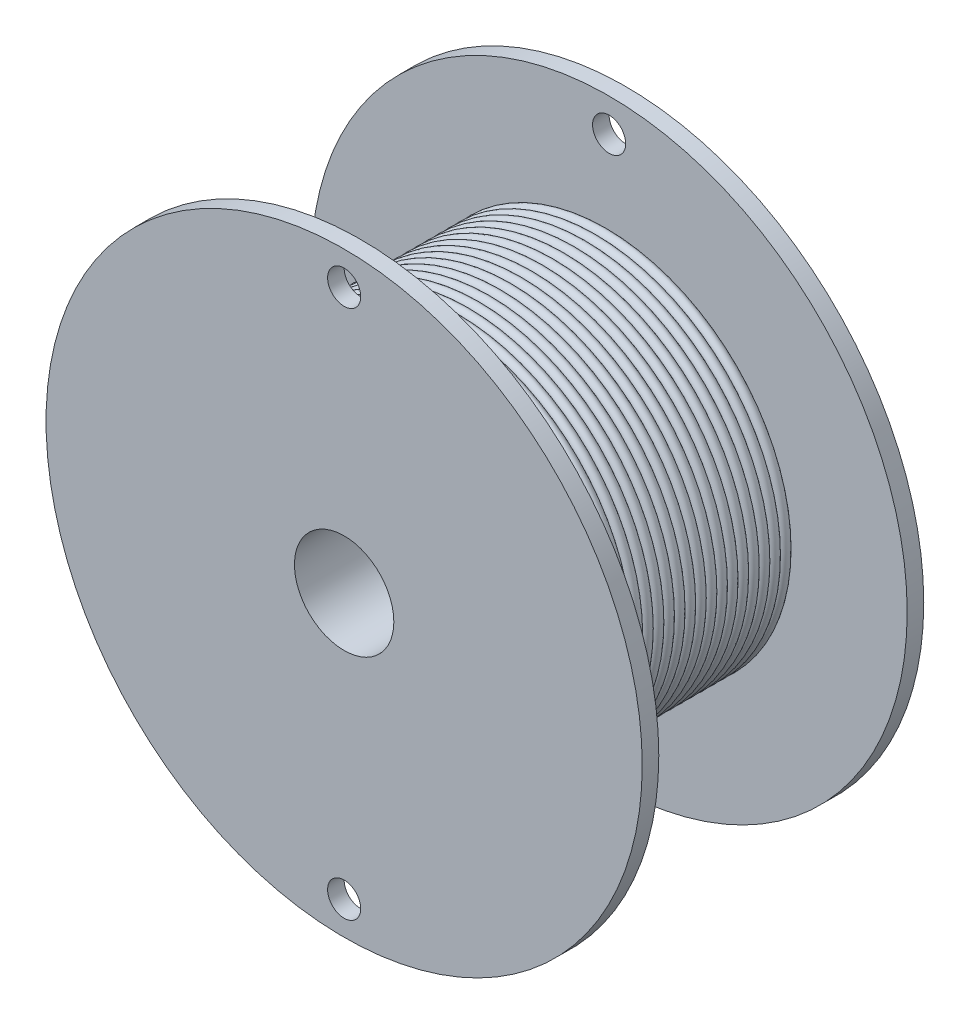
from build123d import *

# Parameters (mm, degrees)
SKETCH_1_R             = 90
EXTRUDE_1_DEPTH        = 5
SKETCH_2_R             = 30
EXTRUDE_2_DEPTH        = 80
PATTERN_LINEAR_1_COUNT = 2
PATTERN_LINEAR_1_PITCH = 80
SKETCH_5_R             = 1.532153127
SKETCH_6_R             = 15
SKETCH_6_R_2           = 5
CUT_EXTRUDE_1_DEPTH    = 154.05227865


with BuildPart() as part:
    # 草圖1 → 填料-伸長1 (new body)
    with BuildSketch(Plane.XY):
        Circle(SKETCH_1_R)
    extrude_1 = extrude(amount=EXTRUDE_1_DEPTH)

    # 草圖2 → 填料-伸長2 (add)
    with BuildSketch(Plane(origin=(0, 0, 0), x_dir=(-1, 0, 0), z_dir=(0, 0, -1))):
        with Locations(Location((0, 0, 0), (0, 0, 180))):
            Circle(SKETCH_2_R)
    extrude(amount=EXTRUDE_2_DEPTH)

    # 直線複製排列1: 填料-伸長1 ×2
    with Locations(*[(0, 0, -i * PATTERN_LINEAR_1_PITCH) for i in range(1, PATTERN_LINEAR_1_COUNT)]):
        add(extrude_1)

    # 草圖6 → 除料-伸長1 (cut, through all)
    with BuildSketch(Plane.XY.offset(5)):
        Circle(SKETCH_6_R)
        with Locations((0, 80)):
            Circle(SKETCH_6_R_2)
        with Locations((0, -80)):
            Circle(SKETCH_6_R_2)
    extrude(amount=-CUT_EXTRUDE_1_DEPTH, mode=Mode.SUBTRACT)


with BuildPart() as body_2:
    # 草圖5 → 旋轉2 (revolve)
    with BuildSketch(Plane(origin=(0, 0, 0), x_dir=(0, 0, -1), z_dir=(1, 0, 0)), mode=Mode.PRIVATE) as revolve_2_sk:
        with Locations((2.530298984, 54.841798539)):
            Circle(SKETCH_5_R)
        with Locations((5.730298984, 54.841798539)):
            Circle(SKETCH_5_R)
        with Locations((8.930298984, 54.841798539)):
            Circle(SKETCH_5_R)
        with Locations((12.130298984, 54.841798539)):
            Circle(SKETCH_5_R)
        with Locations((15.330298984, 54.841798539)):
            Circle(SKETCH_5_R)
        with Locations((18.530298984, 54.841798539)):
            Circle(SKETCH_5_R)
        with Locations((21.730298984, 54.841798539)):
            Circle(SKETCH_5_R)
        with Locations((24.930298984, 54.841798539)):
            Circle(SKETCH_5_R)
        with Locations((28.130298984, 54.841798539)):
            Circle(SKETCH_5_R)
        with Locations((31.330298984, 54.841798539)):
            Circle(SKETCH_5_R)
        with Locations((34.530298984, 54.841798539)):
            Circle(SKETCH_5_R)
        with Locations((37.730298984, 54.841798539)):
            Circle(SKETCH_5_R)
        with Locations((40.930298984, 54.841798539)):
            Circle(SKETCH_5_R)
        with Locations((44.130298984, 54.841798539)):
            Circle(SKETCH_5_R)
        with Locations((47.330298984, 54.841798539)):
            Circle(SKETCH_5_R)
        with Locations((50.530298984, 54.841798539)):
            Circle(SKETCH_5_R)
        with Locations((53.730298984, 54.841798539)):
            Circle(SKETCH_5_R)
        with Locations((56.930298984, 54.841798539)):
            Circle(SKETCH_5_R)
        with Locations((60.130298984, 54.841798539)):
            Circle(SKETCH_5_R)
        with Locations((63.330298984, 54.841798539)):
            Circle(SKETCH_5_R)
        with Locations((66.530298984, 54.841798539)):
            Circle(SKETCH_5_R)
        with Locations((69.730298984, 54.841798539)):
            Circle(SKETCH_5_R)
        with Locations((72.930298984, 54.841798539)):
            Circle(SKETCH_5_R)
    revolve(revolve_2_sk.sketch.rotate(Axis((0, 0, -80), (0, 0, 1)), 90), axis=Axis((0, 0, -80), (0, 0, 1)))


solid = Compound([part.part, body_2.part])
